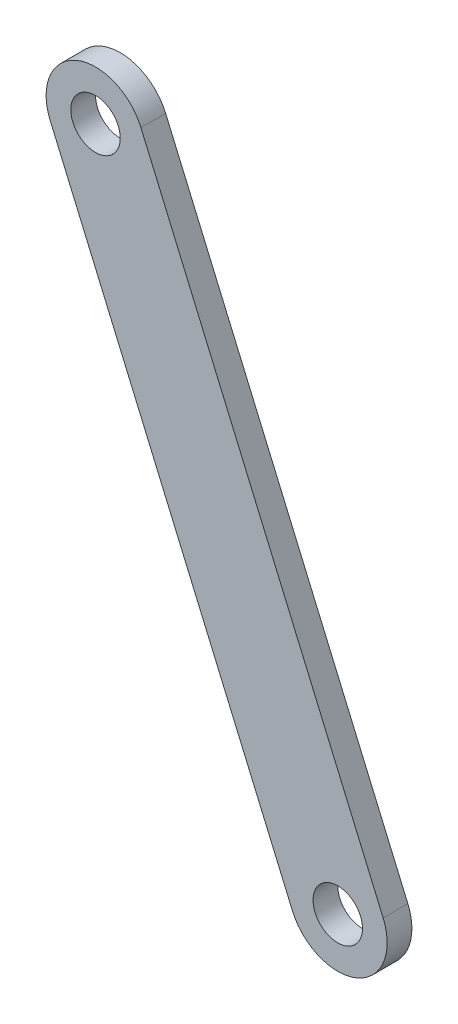
from build123d import *

# Parameters (mm, degrees)
SKETCH1_R           = 1.5875
BOSS_EXTRUDE1_DEPTH = 1.5875


with BuildPart() as part:
    # Sketch1 → Boss-Extrude1 (new body)
    with BuildSketch(Plane.XY):
        with BuildLine():
            Line((-71.877547643, 9.397283152), (-56.314697223, -26.798817285))
            ThreePointArc((-56.314697223, -26.798817285), (-57.977402015, -30.969747969), (-62.1483327, -29.307043177))
            Line((-62.1483327, -29.307043177), (-77.711183119, 6.88905726))
            ThreePointArc((-77.711183119, 6.88905726), (-76.048478327, 11.059987944), (-71.877547643, 9.397283152))
        make_face()
        with Locations((-59.231514961, -28.052930231)):
            Circle(SKETCH1_R, mode=Mode.SUBTRACT)
        with Locations((-74.794365381, 8.143170206)):
            Circle(SKETCH1_R, mode=Mode.SUBTRACT)
    extrude(amount=BOSS_EXTRUDE1_DEPTH)


solid = part.part
